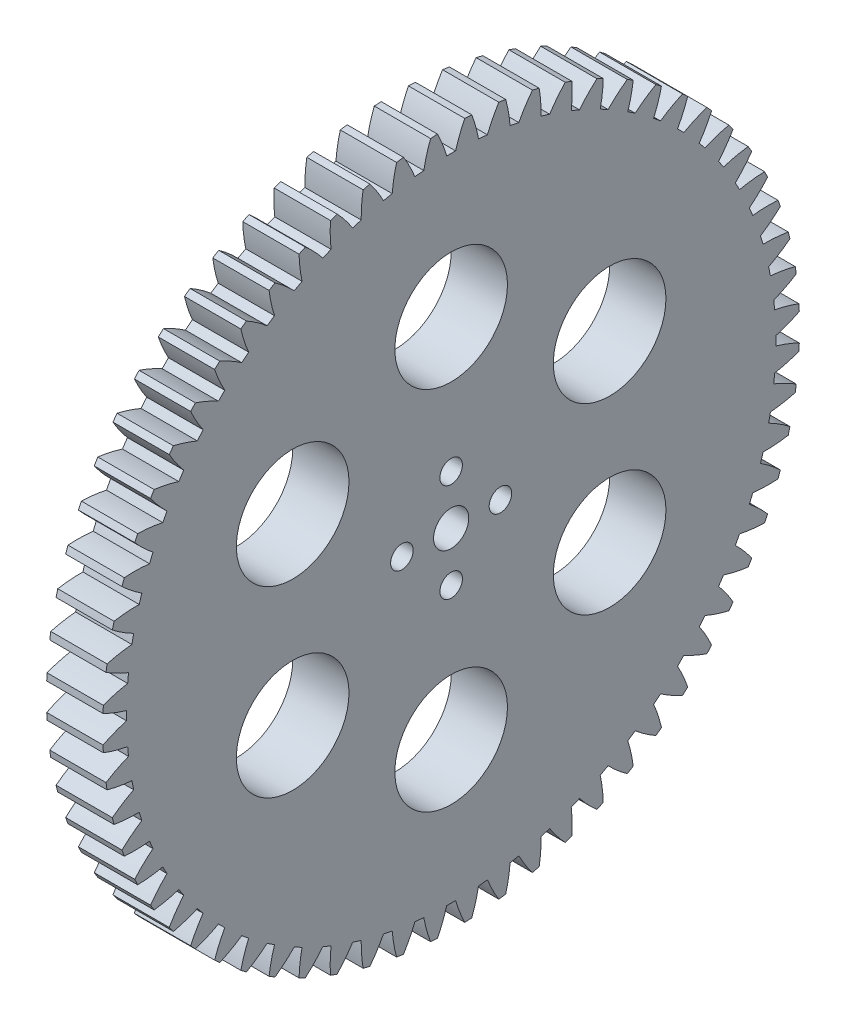
from build123d import *

# Parameters (mm, degrees)
BASPROSKE_W         = 8
BASPROSKE_H         = 49.5
TOOTHCUT_DEPTH      = 71.459208057
TEETHCUTS_COUNT     = 64
TEETHCUTS_ANGLE     = 354.375
BORSKE_R            = 2.5
BORE_DEPTH          = 50.0000508
SKETCH_1_R          = 1.6
SKETCH_1_R_2        = 8
CUT_EXTRUDE_2_DEPTH = 71.406036728


with BuildPart() as part:
    # BasProSke → Base-Revolve (revolve)
    with BuildSketch(Plane(origin=(0, 0, 0), x_dir=(1, 0, 0), z_dir=(0, 1, 0)), mode=Mode.PRIVATE) as base_revolve_sk:
        with Locations((4, 24.75)):
            Rectangle(BASPROSKE_W, BASPROSKE_H)
    revolve(base_revolve_sk.sketch.rotate(Axis((-10, 0, 0), (1, 0, 0)), 180), axis=Axis((-10, 0, 0), (1, 0, 0)))

    # TooCutSke → ToothCut (cut, through all)
    with BuildSketch(Plane(origin=(0, 0, 0), x_dir=(0, 0, -1), z_dir=(1, 0, 0))):
        with BuildLine():
            ThreePointArc((0.635076871, 46.119627637), (0, 46.124), (-0.635076871, 46.119627637))
            ThreePointArc((-0.635076871, 46.119627637), (-1.211981228, 47.834312084), (-1.947712443, 49.487085804))
            ThreePointArc((-1.947712443, 49.487085804), (0, 49.5254), (1.947712443, 49.487085804))
            ThreePointArc((1.947712443, 49.487085804), (1.211981228, 47.834312084), (0.635076871, 46.119627637))
        make_face()
    toothcut = extrude(amount=TOOTHCUT_DEPTH, mode=Mode.SUBTRACT)

    # TeethCuts: ToothCut ×64 about axis
    teethcuts_axis = Axis((-10, 0, 0), (1, 0, 0))
    for i in range(1, TEETHCUTS_COUNT):
        add(toothcut.rotate(teethcuts_axis, i * TEETHCUTS_ANGLE / (TEETHCUTS_COUNT - 1)), mode=Mode.SUBTRACT)

    # BorSke → Bore (cut, symmetric)
    with BuildSketch(Plane(origin=(0, 0, 0), x_dir=(0, 0, -1), z_dir=(1, 0, 0))):
        with Locations(Location((0, 0, 0), (0, 0, 180))):
            Circle(BORSKE_R)
    extrude(amount=BORE_DEPTH, both=True, mode=Mode.SUBTRACT)

    # 草图1 → 切除-拉伸2 (cut, through all)
    with BuildSketch(Plane(origin=(0, 0, 0), x_dir=(0, 0, -1), z_dir=(1, 0, 0))):
        with Locations((0, 7)):
            Circle(SKETCH_1_R)
        with Locations((7, 0)):
            Circle(SKETCH_1_R)
        with Locations((0, -7)):
            Circle(SKETCH_1_R)
        with Locations((-7, 0)):
            Circle(SKETCH_1_R)
        with Locations((0, 26)):
            Circle(SKETCH_1_R_2)
        with Locations((22.516660498, 13)):
            Circle(SKETCH_1_R_2)
        with Locations((22.516660498, -13)):
            Circle(SKETCH_1_R_2)
        with Locations((0, -26)):
            Circle(SKETCH_1_R_2)
        with Locations((-22.516660498, -13)):
            Circle(SKETCH_1_R_2)
        with Locations((-22.516660498, 13)):
            Circle(SKETCH_1_R_2)
    extrude(amount=CUT_EXTRUDE_2_DEPTH, mode=Mode.SUBTRACT)


solid = part.part
